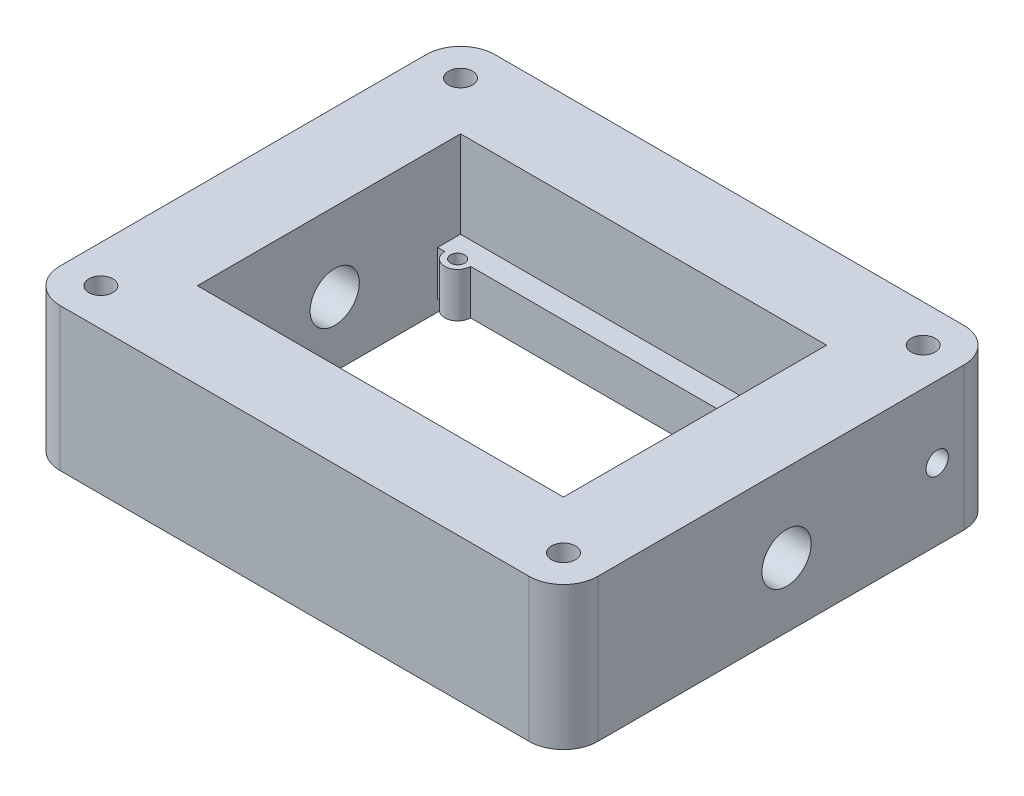
from build123d import *

# Parameters (mm, degrees)
SKETCH1_W               = 94
SKETCH1_H               = 76
SKETCH1_R               = 1.25
BOSS_EXTRUDE1_DEPTH     = 9.8
SKETCH2_W               = 94
SKETCH2_H               = 76
SKETCH2_W_2             = 64
SKETCH2_H_2             = 46
BOSS_EXTRUDE3_DEPTH     = 15.2
SKETCH3_W               = 64
SKETCH3_H               = 46
CUT_EXTRUDE1_DEPTH      = 2
CUT_EXTRUDE2_DEPTH      = 105.427008001
CUT_EXTRUDE2_DEPTH_BACK = 105.427008001
SKETCH4_R               = 4.305
CUT_EXTRUDE3_DEPTH      = 66.406421703
CUT_EXTRUDE3_DEPTH_BACK = 66.406421703
SKETCH5_R               = 2.1
FILLET1_R               = 6
CUT_SWEEP_PROFILE_R     = 1.95


with BuildPart() as part:
    # Sketch1 → Boss-Extrude1 (new body)
    with BuildSketch(Plane(origin=(0, 0, 0), x_dir=(1, 0, 0), z_dir=(0, 1, 0))):
        Rectangle(SKETCH1_W, SKETCH1_H)
        with BuildLine():
            Line((-32, 19), (-30.75, 19))
            ThreePointArc((-30.75, 19), (-28.5, 16.75), (-26.25, 19))
            Line((-26.25, 19), (26.25, 19))
            ThreePointArc((26.25, 19), (28.5, 16.75), (30.75, 19))
            Line((30.75, 19), (32, 19))
            Line((32, 19), (32, -19))
            Line((32, -19), (30.75, -19))
            ThreePointArc((30.75, -19), (28.5, -16.75), (26.25, -19))
            Line((26.25, -19), (-26.25, -19))
            ThreePointArc((-26.25, -19), (-28.5, -16.75), (-30.75, -19))
            Line((-30.75, -19), (-32, -19))
            Line((-32, -19), (-32, 19))
        make_face(mode=Mode.SUBTRACT)
        with Locations(Location((-28.5, 19, 0), (0, 0, 270))):
            Circle(SKETCH1_R, mode=Mode.SUBTRACT)
        with Locations(Location((28.5, 19, 0), (0, 0, 270))):
            Circle(SKETCH1_R, mode=Mode.SUBTRACT)
        with Locations(Location((28.5, -19, 0), (0, 0, 270))):
            Circle(SKETCH1_R, mode=Mode.SUBTRACT)
        with Locations(Location((-28.5, -19, 0), (0, 0, 270))):
            Circle(SKETCH1_R, mode=Mode.SUBTRACT)
    extrude(amount=BOSS_EXTRUDE1_DEPTH)

    # Sketch2 → Boss-Extrude3 (add)
    with BuildSketch(Plane(origin=(0, 9.8, 0), x_dir=(1, 0, 0), z_dir=(0, 1, 0))):
        Rectangle(SKETCH2_W, SKETCH2_H)
        Rectangle(SKETCH2_W_2, SKETCH2_H_2, mode=Mode.SUBTRACT)
    extrude(amount=BOSS_EXTRUDE3_DEPTH)

    # Sketch3 → Cut-Extrude1 (cut)
    with BuildSketch(Plane.XZ):
        Rectangle(SKETCH3_W, SKETCH3_H)
    extrude(amount=-CUT_EXTRUDE1_DEPTH, mode=Mode.SUBTRACT)

    # Sketch4 → Cut-Extrude2 (cut, two sides: drawn at the far end of the back side and taken through both)
    with BuildSketch(Plane(origin=(47, 0, 0), x_dir=(0, 0, -1), z_dir=(1, 0, 0)).offset(-CUT_EXTRUDE2_DEPTH_BACK)):
        with Locations((1, 11.3)):
            Circle(SKETCH4_R)
    extrude(amount=CUT_EXTRUDE2_DEPTH + CUT_EXTRUDE2_DEPTH_BACK, mode=Mode.SUBTRACT)

    # Sketch5 → Cut-Extrude3 (cut, two sides: drawn at the far end of the back side and taken through both)
    with BuildSketch(Plane(origin=(0, 25, 0), x_dir=(1, 0, 0), z_dir=(0, 1, 0)).offset(-CUT_EXTRUDE3_DEPTH_BACK)):
        with Locations(Location((-40.44, 31.44, 0), (0, 0, 270))):
            Circle(SKETCH5_R)
        with Locations(Location((40.44, 31.44, 0), (0, 0, 270))):
            Circle(SKETCH5_R)
        with Locations(Location((40.44, -31.44, 0), (0, 0, 270))):
            Circle(SKETCH5_R)
        with Locations(Location((-40.44, -31.44, 0), (0, 0, 270))):
            Circle(SKETCH5_R)
    extrude(amount=CUT_EXTRUDE3_DEPTH + CUT_EXTRUDE3_DEPTH_BACK, mode=Mode.SUBTRACT)

    # Fillet1
    fillet1_edges = [part.edges().sort_by_distance(p)[0] for p in [
        (-47, 12.5, 38),
        (-47, 12.5, -38),
        (47, 12.5, -38),
        (47, 12.5, 38),
    ]]
    fillet(fillet1_edges, radius=FILLET1_R)

    # Cut-Sweep: sweep along a path in Sketch9
    with BuildLine(Plane(origin=(0, 12.5, 0), x_dir=(-1, 0, 0), z_dir=(0, -1, 0))) as cut_sweep_path:
        Line((-47, 27.34), (-40.44, 27.34))
        ThreePointArc((-40.44, 27.34), (-37.540862197, 28.540862197), (-36.34, 31.44))
        Line((-36.34, 31.44), (-36.34, 38))
    # Cut-Sweep profile (on start of the path) → Cut-Sweep (sweep, cut)
    with BuildSketch(Plane(origin=(47, 12.5, -27.34), x_dir=(0, 0, -1), z_dir=(-1, 0, 0))):
        Circle(CUT_SWEEP_PROFILE_R)
    sweep(path=cut_sweep_path.line, mode=Mode.SUBTRACT)


solid = part.part
